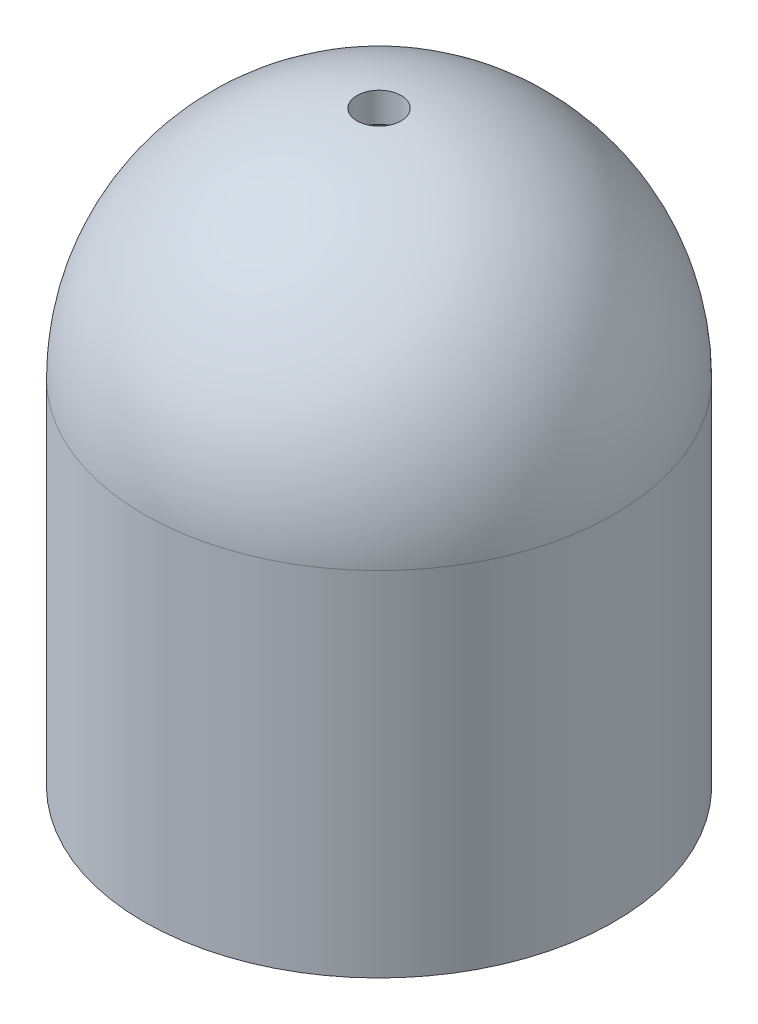
from build123d import *

# Parameters (mm, degrees)
SKETCH2_R          = 4.7625
CUT_EXTRUDE2_DEPTH = 54.61


with BuildPart() as part:
    # Sketch1 → Revolve1 (revolve)
    with BuildSketch(Plane.XY, mode=Mode.PRIVATE) as revolve1_sk:
        with BuildLine():
            Line((44.45, 50.8), (44.45, 44.45))
            ThreePointArc((44.45, 44.45), (13.019103576, 31.430896424), (0, 0))
            Line((0, 0), (0, -76.2))
            Line((0, -76.2), (-6.35, -76.2))
            Line((-6.35, -76.2), (-6.35, 0))
            ThreePointArc((-6.35, 0), (8.528975516, 35.921024484), (44.45, 50.8))
        make_face()
    revolve(revolve1_sk.sketch.rotate(Axis((44.45, 50.8, 0), (0, -1, 0)), 270), axis=Axis((44.45, 50.8, 0), (0, -1, 0)))

    # Sketch2 → Cut-Extrude2 (cut)
    with BuildSketch(Plane(origin=(0, 0, 0), x_dir=(1, 0, 0), z_dir=(0, 1, 0))):
        with Locations(Location((44.45, 0, 0), (0, 0, 90))):
            Circle(SKETCH2_R)
    extrude(amount=CUT_EXTRUDE2_DEPTH, mode=Mode.SUBTRACT)


solid = part.part
